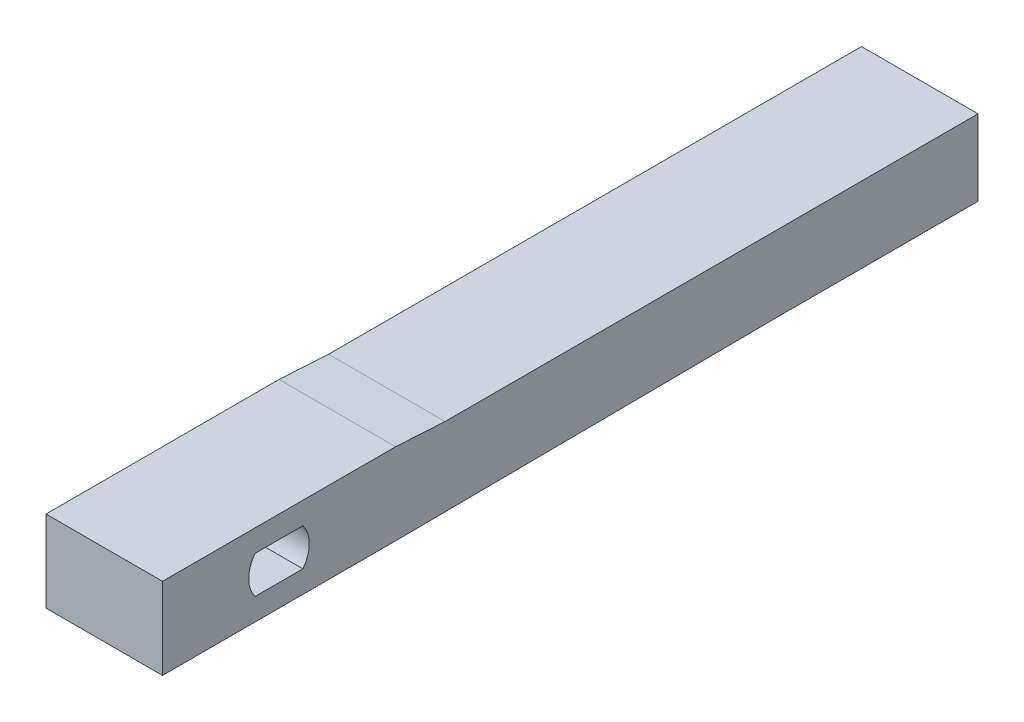
from build123d import *

# Parameters (mm, degrees)
BOSS_EXTRUDE1_DEPTH = 10


with BuildPart() as part:
    # Sketch1 → Boss-Extrude1 (new body)
    with BuildSketch(Plane.ZY.offset(4)):
        Polygon((-10, 11.5), (10, 11.5), (10, 4.5), (-10, 4.5), (-42.635866967, 4.75), (-60, 4.75), (-60, 11.25), (-14.260924963, 11.25), align=None)
        with BuildLine():
            Line((-2.049390153, 9.6), (2.049390153, 9.6))
            ThreePointArc((2.049390153, 9.6), (2.6, 8), (2.049390153, 6.4))
            Line((2.049390153, 6.4), (-2.049390153, 6.4))
            ThreePointArc((-2.049390153, 6.4), (-2.6, 8), (-2.049390153, 9.6))
        make_face(mode=Mode.SUBTRACT)
    extrude(amount=BOSS_EXTRUDE1_DEPTH)


solid = part.part
